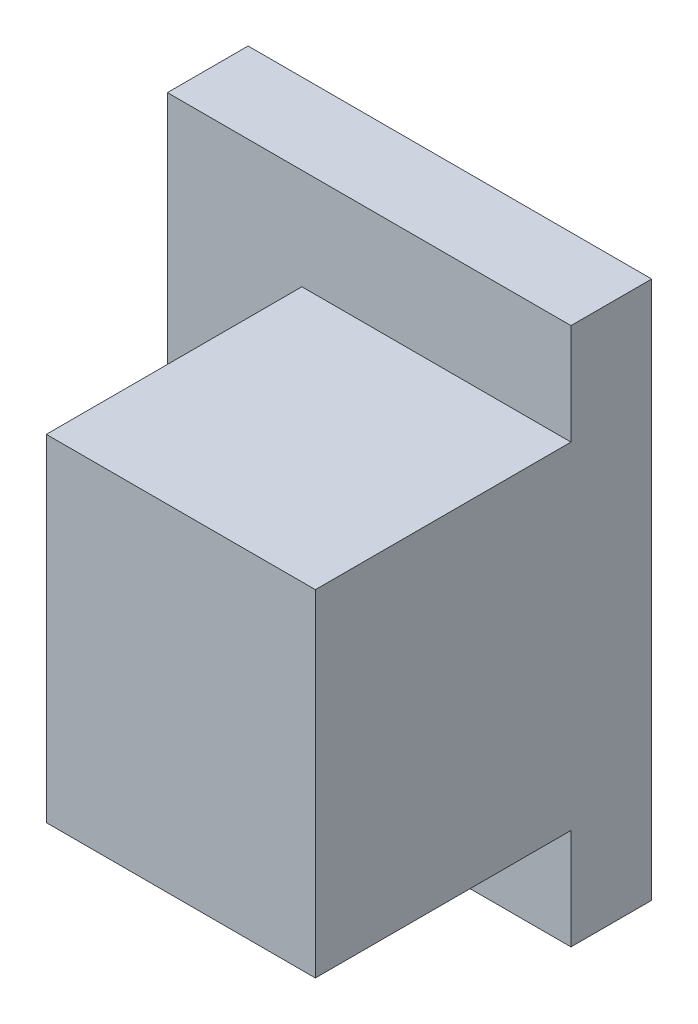
from build123d import *

# Parameters (mm, degrees)
SKETCH_1_W      = 4
SKETCH_1_H      = 5
SKETCH_1_W_2    = 2
SKETCH_1_H_2    = 3
EXTRUDE_1_DEPTH = 4
EXTRUDE_2_DEPTH = 1.2
SKETCH_3_W      = 4
SKETCH_3_H      = 5
EXTRUDE_3_DEPTH = 1


with BuildPart() as part:
    # 草图1 → 凸台-拉伸1 (new body)
    with BuildSketch(Plane.XY):
        with Locations((1, 1.5)):
            Rectangle(SKETCH_1_W, SKETCH_1_H)
        with Locations((1, 1.5)):
            Rectangle(SKETCH_1_W_2, SKETCH_1_H_2, mode=Mode.SUBTRACT)
    extrude(amount=EXTRUDE_1_DEPTH)

    # 草图2 → 凸台-拉伸2 (add)
    with BuildSketch(Plane(origin=(0, 0, 0), x_dir=(-1, 0, 0), z_dir=(0, 0, -1))):
        Polygon((-3, 4), (1, 4), (1, -1), (-3, -1), (-3, -2.5), (3, -2.5), (3, 5.5), (-3, 5.5), align=None)
    extrude(amount=-EXTRUDE_2_DEPTH)

    # 草图3 → 凸台-拉伸3 (add)
    with BuildSketch(Plane.XY.offset(4)):
        with Locations((1, 1.5)):
            Rectangle(SKETCH_3_W, SKETCH_3_H)
    extrude(amount=EXTRUDE_3_DEPTH)


solid = part.part
